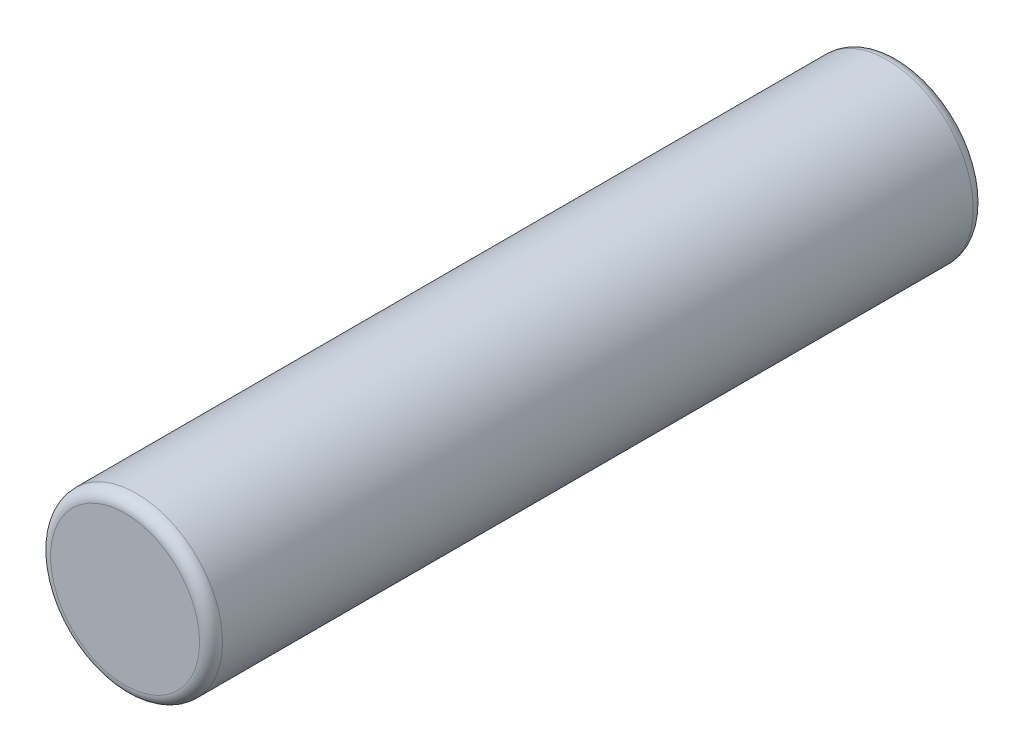
from build123d import *

# Parameters (mm, degrees)
SKETCH1_R           = 1.5
BOSS_EXTRUDE1_DEPTH = 13.5
FILLET1_R           = 0.2


with BuildPart() as part:
    # Sketch1 → Boss-Extrude1 (new body)
    with BuildSketch(Plane.XY):
        Circle(SKETCH1_R)
    extrude(amount=BOSS_EXTRUDE1_DEPTH)

    # Fillet1
    fillet1_edges = [part.edges().sort_by_distance(p)[0] for p in [
        (-1.5, 0, 0),
        (-1.5, 0, 13.5),
    ]]
    fillet(fillet1_edges, radius=FILLET1_R)


solid = part.part
